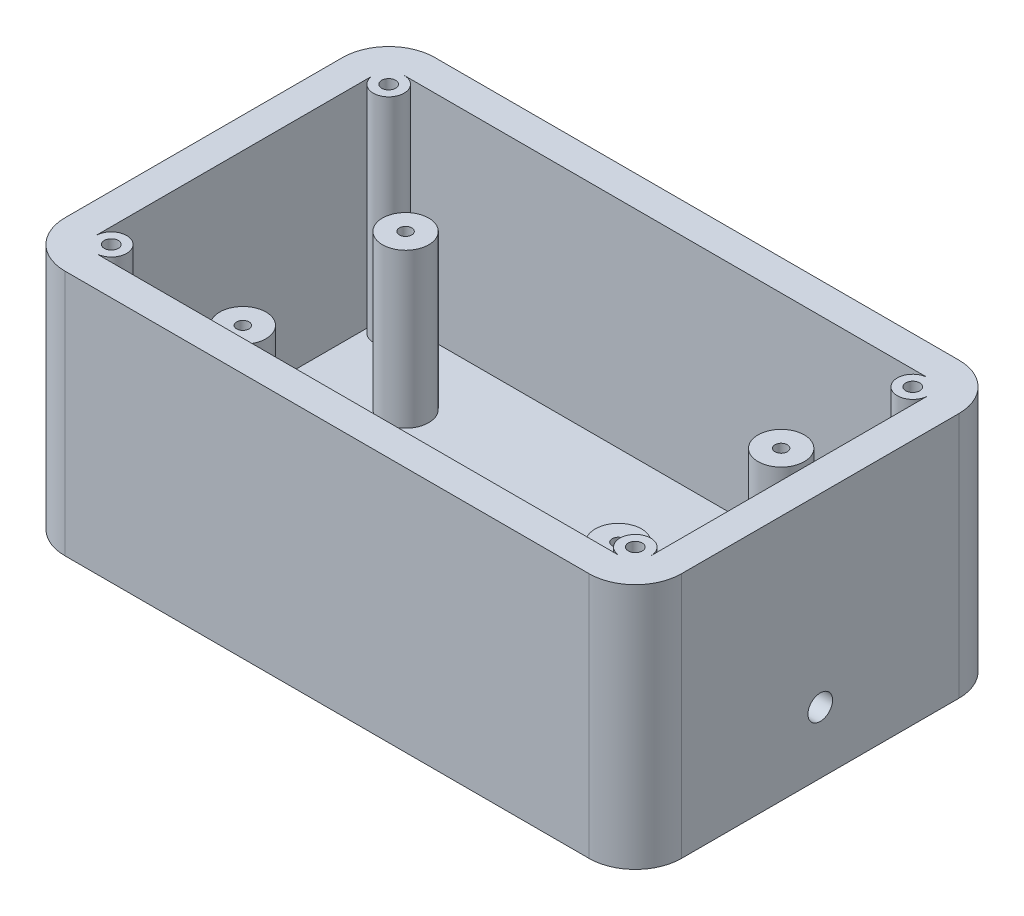
from build123d import *

# Parameters (mm, degrees)
SKETCH1_W                 = 127
SKETCH1_H                 = 76.2
BOSS_EXTRUDE1_DEPTH       = 50.8
FILLET1_R                 = 9.525
SHELL2_T                  = -6.35
SKETCH2_R                 = 3.175
BOSS_EXTRUDE2_DEPTH       = 44.45
MIRROR2_COPY_1_SKETCH_R   = 3.175
MIRROR2_COPY_1_DEPTH      = 44.45
F_6_40_TAPPED_HOLE1_D     = 2.8702
F_6_40_TAPPED_HOLE1_DEPTH = 12.7
F_6_40_TAPPED_HOLE1_TIP   = 0.862295074
SKETCH4_R                 = 4.7625
BOSS_EXTRUDE3_DEPTH       = 31.75
F_6_40_TAPPED_HOLE2_D     = 2.54
F_6_40_TAPPED_HOLE2_DEPTH = 8.9154
F_6_40_TAPPED_HOLE2_TIP   = 0.763092986
SKETCH7_R                 = 2.667
CUT_EXTRUDE1_DEPTH        = 12.7
SKETCH8_R                 = 2.54
CUT_EXTRUDE2_DEPTH        = 13.97
F_6_40_TAPPED_HOLE3_D     = 2.54
F_6_40_TAPPED_HOLE3_DEPTH = 8.9154
F_6_40_TAPPED_HOLE3_TIP   = 0.763092986


with BuildPart() as part:
    # Sketch1 → Boss-Extrude1 (new body)
    with BuildSketch(Plane(origin=(0, 0, 0), x_dir=(1, 0, 0), z_dir=(0, 1, 0))):
        Rectangle(SKETCH1_W, SKETCH1_H)
    extrude(amount=-BOSS_EXTRUDE1_DEPTH)

    # Fillet1
    fillet1_edges = [part.edges().sort_by_distance(p)[0] for p in [
        (63.5, -25.4, 38.1),
        (-63.5, -25.4, 38.1),
        (-63.5, -25.4, -38.1),
        (63.5, -25.4, -38.1),
    ]]
    fillet(fillet1_edges, radius=FILLET1_R)

    # Shell2
    shell2_openings = [part.faces().sort_by_distance(p)[0] for p in [
        (0, 0, 0),
    ]]
    offset(amount=SHELL2_T, openings=shell2_openings, kind=Kind.INTERSECTION)

    # Sketch2 → Boss-Extrude2 (add)
    with BuildSketch(Plane(origin=(0, -44.45, 0), x_dir=(1, 0, 0), z_dir=(0, 1, 0))):
        with Locations((-53.975, 28.575)):
            Circle(SKETCH2_R)
    boss_extrude2 = extrude(amount=BOSS_EXTRUDE2_DEPTH)

    # Mirror1: Boss-Extrude2 across plane
    add(boss_extrude2.mirror(Plane(origin=(0, 0, 0), x_dir=(0, 0, 1), z_dir=(1, 0, 0))))

    # Mirror2: Boss-Extrude2 across plane
    add(boss_extrude2.mirror(Plane.XY))

    # Mirror2 copy 1 sketch → Mirror2 copy 1 (add)
    with BuildSketch(Plane(origin=(0, -44.45, 0), x_dir=(-1, 0, 0), z_dir=(0, 1, 0))):
        with Locations((-53.975, 28.575)):
            Circle(MIRROR2_COPY_1_SKETCH_R)
    extrude(amount=MIRROR2_COPY_1_DEPTH)

    # #6-40 Tapped Hole1
    with Locations(Plane(origin=(-53.975, 0, -28.575), x_dir=(0, 0, 1), z_dir=(0, 1, 0))):
        with Locations((0, 0), (57.15, 0), (57.15, 107.95), (0, 107.95)):
            Hole(F_6_40_TAPPED_HOLE1_D / 2, depth=F_6_40_TAPPED_HOLE1_DEPTH)
            with Locations((0, 0, -(F_6_40_TAPPED_HOLE1_DEPTH + F_6_40_TAPPED_HOLE1_TIP / 2))):  # 118° drill point
                Cone(0, F_6_40_TAPPED_HOLE1_D / 2, F_6_40_TAPPED_HOLE1_TIP, mode=Mode.SUBTRACT)

    # Sketch4 → Boss-Extrude3 (add)
    with BuildSketch(Plane(origin=(0, -44.45, 0), x_dir=(1, 0, 0), z_dir=(0, 1, 0))):
        with Locations(Location((-38.6842, 16.764, 0), (0, 0, 90))):
            Circle(SKETCH4_R)
        with Locations(Location((38.6842, 16.764, 0), (0, 0, 90))):
            Circle(SKETCH4_R)
        with Locations(Location((-38.6842, -16.764, 0), (0, 0, 90))):
            Circle(SKETCH4_R)
        with Locations(Location((38.6842, -16.764, 0), (0, 0, 90))):
            Circle(SKETCH4_R)
    extrude(amount=BOSS_EXTRUDE3_DEPTH)

    # #6-40 Tapped Hole2
    with Locations(Plane(origin=(-38.6842, -12.7, -16.764), x_dir=(0, 0, 1), z_dir=(0, 1, 0))):
        with Locations((0, 0), (0, 77.3684), (33.528, 0), (33.528, 77.3684)):
            Hole(F_6_40_TAPPED_HOLE2_D / 2, depth=F_6_40_TAPPED_HOLE2_DEPTH)
            with Locations((0, 0, -(F_6_40_TAPPED_HOLE2_DEPTH + F_6_40_TAPPED_HOLE2_TIP / 2))):  # 118° drill point
                Cone(0, F_6_40_TAPPED_HOLE2_D / 2, F_6_40_TAPPED_HOLE2_TIP, mode=Mode.SUBTRACT)

    # Sketch7 → Cut-Extrude1 (cut)
    with BuildSketch(Plane.ZY.offset(63.5)):
        with Locations((0, -38.1)):
            Circle(SKETCH7_R)
    extrude(amount=-CUT_EXTRUDE1_DEPTH, mode=Mode.SUBTRACT)

    # Sketch8 → Cut-Extrude2 (cut)
    with BuildSketch(Plane(origin=(63.5, 0, 0), x_dir=(0, 0, -1), z_dir=(1, 0, 0))):
        with Locations((0, -38.1)):
            Circle(SKETCH8_R)
    extrude(amount=-CUT_EXTRUDE2_DEPTH, mode=Mode.SUBTRACT)

    # #6-40 Tapped Hole3
    with Locations(Plane(origin=(-38.6842, -50.8, -16.764), x_dir=(0, 0, -1), z_dir=(0, -1, 0))):
        with Locations((0, 0), (-33.528, 0), (-33.528, 77.3684), (0, 77.3684)):
            Hole(F_6_40_TAPPED_HOLE3_D / 2, depth=F_6_40_TAPPED_HOLE3_DEPTH)
            with Locations((0, 0, -(F_6_40_TAPPED_HOLE3_DEPTH + F_6_40_TAPPED_HOLE3_TIP / 2))):  # 118° drill point
                Cone(0, F_6_40_TAPPED_HOLE3_D / 2, F_6_40_TAPPED_HOLE3_TIP, mode=Mode.SUBTRACT)


solid = part.part
